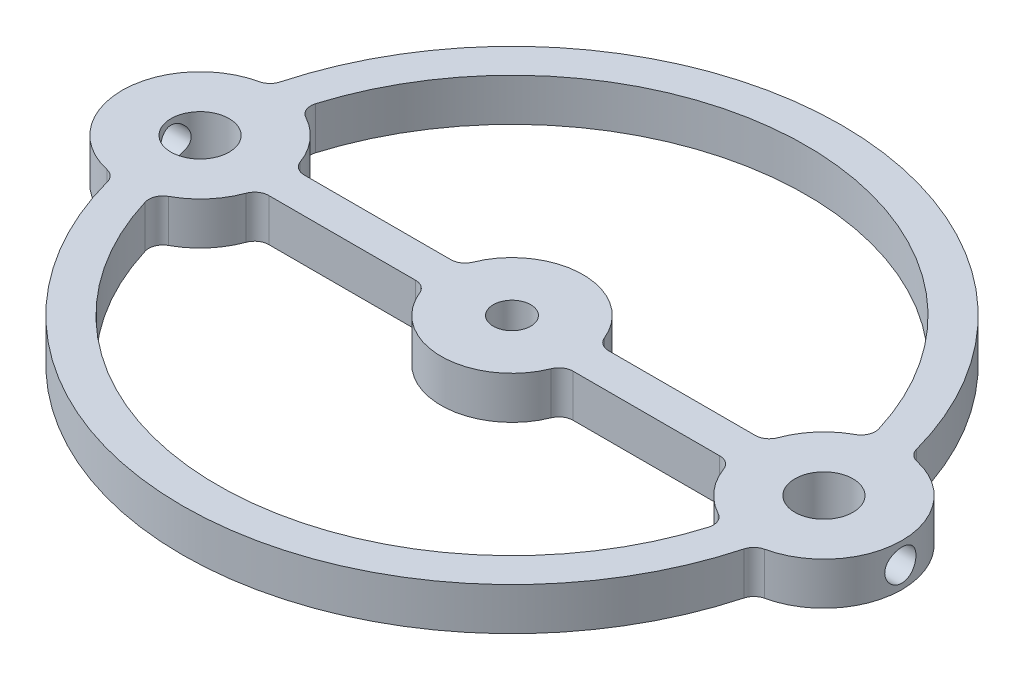
from build123d import *

# Parameters (mm, degrees)
SKETCH1_R               = 12.7
SKETCH1_R_2             = 3.3528
BOSS_EXTRUDE1_DEPTH     = 3.81
SKETCH2_R               = 5.207
BOSS_EXTRUDE2_DEPTH     = 3.81
CUT_EXTRUDE1_REACH      = 85.81
CUT_EXTRUDE1_END_RADIUS = 5.207
SKETCH3_R               = 2.794
BOSS_EXTRUDE3_DEPTH     = 3.81
FILLET1_R               = 2.54


with BuildPart() as part:
    # Sketch1 → Boss-Extrude1 (new, symmetric)
    with BuildSketch(Plane(origin=(0, 0, 0), x_dir=(1, 0, 0), z_dir=(0, 1, 0))):
        with Locations(Location((0, 0, 0), (0, 0, 90))):
            Circle(SKETCH1_R)
        with Locations(Location((0, 0, 0), (0, 0, 90))):
            Circle(SKETCH1_R_2, mode=Mode.SUBTRACT)
    extrude(amount=BOSS_EXTRUDE1_DEPTH, both=True)

    # Sketch2 → Boss-Extrude2 (add, symmetric)
    with BuildSketch(Plane(origin=(0, 0, 0), x_dir=(1, 0, 0), z_dir=(0, 1, 0))):
        with BuildLine():
            Line((12.296722124, 3.175), (42.275578844, 3.175))
            ThreePointArc((42.275578844, 3.175), (69.85, 0), (42.275578844, -3.175))
            Line((42.275578844, -3.175), (12.296722124, -3.175))
            ThreePointArc((12.296722124, -3.175), (12.7, 0), (12.296722124, 3.175))
        make_face()
        with Locations(Location((55.88, 0, 0), (0, 0, 90))):
            Circle(SKETCH2_R, mode=Mode.SUBTRACT)
    boss_extrude2 = extrude(amount=BOSS_EXTRUDE2_DEPTH, both=True)

    # Cut-Extrude1: up to this cylinder (the profile starts outside it)
    cut_extrude1_end = Plane(origin=(55.88, 0, 0), z_dir=(0, -1, 0)) * Cylinder(CUT_EXTRUDE1_END_RADIUS, 183.034, mode=Mode.PRIVATE)
    # Sketch3 → Cut-Extrude1 (cut, up to the surface)
    with BuildSketch(Plane(origin=(69.85, 0, 0), x_dir=(0, 0, -1), z_dir=(1, 0, 0)), mode=Mode.PRIVATE) as cut_extrude1_sk1:
        Circle(SKETCH3_R)
    cut_extrude1_tool1 = extrude(cut_extrude1_sk1.sketch, amount=-CUT_EXTRUDE1_REACH, mode=Mode.PRIVATE) - cut_extrude1_end
    cut_extrude1 = cut_extrude1_tool1.solids().sort_by_distance((69.85, 0, 0))[0]
    add(cut_extrude1, mode=Mode.SUBTRACT)

    # Mirror1: Boss-Extrude2, Cut-Extrude1 across plane
    add(boss_extrude2.mirror(Plane(origin=(0, 0, 0), x_dir=(0, 0, 1), z_dir=(1, 0, 0))))
    add(cut_extrude1.mirror(Plane(origin=(0, 0, 0), x_dir=(0, 0, 1), z_dir=(1, 0, 0))), mode=Mode.SUBTRACT)

    # Sketch4 → Boss-Extrude3 (add, symmetric)
    with BuildSketch(Plane(origin=(0, 0, 0), x_dir=(1, 0, 0), z_dir=(0, 1, 0))):
        with BuildLine():
            ThreePointArc((-51.048948864, -13.10808319), (-54.178749787, -13.866024943), (-57.398948864, -13.887177336))
            ThreePointArc((-57.398948864, -13.887177336), (0, -59.055), (57.398948864, -13.887177336))
            ThreePointArc((57.398948864, -13.887177336), (54.178749787, -13.866024943), (51.048948864, -13.10808319))
            ThreePointArc((51.048948864, -13.10808319), (0, -52.705), (-51.048948864, -13.10808319))
        make_face()
        with BuildLine():
            ThreePointArc((57.398948864, 13.887177336), (0, 59.055), (-57.398948864, 13.887177336))
            ThreePointArc((-57.398948864, 13.887177336), (-54.178749787, 13.866024943), (-51.048948864, 13.10808319))
            ThreePointArc((-51.048948864, 13.10808319), (0, 52.705), (51.048948864, 13.10808319))
            ThreePointArc((51.048948864, 13.10808319), (54.178749787, 13.866024943), (57.398948864, 13.887177336))
        make_face()
    extrude(amount=BOSS_EXTRUDE3_DEPTH, both=True)

    # Fillet1
    fillet1_edges = [part.edges().sort_by_distance(p)[0] for p in [
        (12.296722124, 0, -3.175),
        (12.296722124, 0, 3.175),
        (42.275578844, 0, 3.175),
        (42.275578844, 0, -3.175),
        (-12.296722124, 0, 3.175),
        (-12.296722124, 0, -3.175),
        (-42.275578844, 0, -3.175),
        (-42.275578844, 0, 3.175),
        (-51.048948864, 0, 13.10808319),
        (-57.398948864, 0, 13.887177336),
        (57.398948864, 0, 13.887177336),
        (51.048948864, 0, 13.10808319),
        (51.048948864, 0, -13.10808319),
        (57.398948864, 0, -13.887177336),
        (-57.398948864, 0, -13.887177336),
        (-51.048948864, 0, -13.10808319),
    ]]
    fillet(fillet1_edges, radius=FILLET1_R)


solid = part.part
